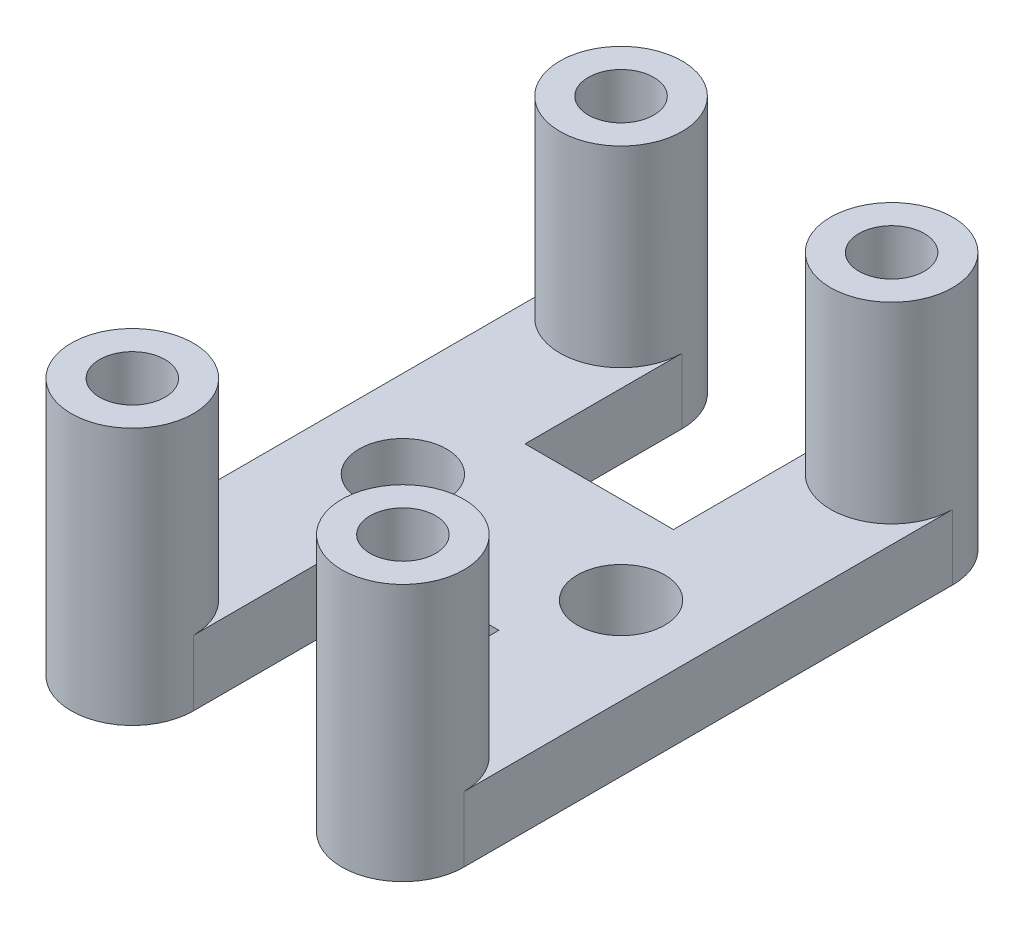
from build123d import *

# Parameters (mm, degrees)
SKETCH1_R           = 2.54
SKETCH1_R_2         = 1.905
BOSS_EXTRUDE1_DEPTH = 3.81
SKETCH4_R           = 3.556
SKETCH4_R_2         = 1.905
BOSS_EXTRUDE4_DEPTH = 11.176


with BuildPart() as part:
    # Sketch1 → Boss-Extrude1 (new body)
    with BuildSketch(Plane(origin=(0, 0, 0), x_dir=(1, 0, 0), z_dir=(0, 1, 0))):
        with BuildLine():
            Line((-9.948186072, 14.224), (-9.948186072, -14.224))
            ThreePointArc((-9.948186072, -14.224), (-6.392186072, -17.78), (-2.836186072, -14.224))
            Line((-2.836186072, -14.224), (-2.836186072, -5.08))
            Line((-2.836186072, -5.08), (5.799813928, -5.08))
            Line((5.799813928, -5.08), (5.799813928, -14.224))
            ThreePointArc((5.799813928, -14.224), (9.355813928, -17.78), (12.911813928, -14.224))
            Line((12.911813928, -14.224), (12.911813928, 14.224))
            ThreePointArc((12.911813928, 14.224), (9.355813928, 17.78), (5.799813928, 14.224))
            Line((5.799813928, 14.224), (5.799813928, 5.08))
            Line((5.799813928, 5.08), (-2.836186072, 5.08))
            Line((-2.836186072, 5.08), (-2.836186072, 14.224))
            ThreePointArc((-2.836186072, 14.224), (-6.392186072, 17.78), (-9.948186072, 14.224))
        make_face()
        with Locations(Location((7.831813928, 0, 0), (0, 0, 90))):
            Circle(SKETCH1_R, mode=Mode.SUBTRACT)
        with Locations(Location((-4.868186072, 0, 0), (0, 0, 90))):
            Circle(SKETCH1_R, mode=Mode.SUBTRACT)
        with Locations(Location((-6.392186072, 14.224, 0), (0, 0, 90))):
            Circle(SKETCH1_R_2, mode=Mode.SUBTRACT)
        with Locations(Location((-6.392186072, -14.224, 0), (0, 0, 90))):
            Circle(SKETCH1_R_2, mode=Mode.SUBTRACT)
        with Locations(Location((9.355813928, 14.224, 0), (0, 0, 90))):
            Circle(SKETCH1_R_2, mode=Mode.SUBTRACT)
        with Locations(Location((9.355813928, -14.224, 0), (0, 0, 90))):
            Circle(SKETCH1_R_2, mode=Mode.SUBTRACT)
    extrude(amount=BOSS_EXTRUDE1_DEPTH)

    # Sketch4 → Boss-Extrude4 (add)
    # profile 1 of 4: a face of its own
    with BuildSketch(Plane(origin=(0, 3.81, 0), x_dir=(1, 0, 0), z_dir=(0, 1, 0))):
        with Locations(Location((-6.392186072, 14.224, 0), (0, 0, 180))):
            Circle(SKETCH4_R)
        with Locations(Location((-6.392186072, 14.224, 0), (0, 0, 90))):
            Circle(SKETCH4_R_2, mode=Mode.SUBTRACT)
    # profile 2 of 4: a face of its own
    with BuildSketch(Plane(origin=(0, 3.81, 0), x_dir=(1, 0, 0), z_dir=(0, 1, 0))):
        with Locations(Location((9.355813928, 14.224, 0), (0, 0, 180))):
            Circle(SKETCH4_R)
        with Locations(Location((9.355813928, 14.224, 0), (0, 0, 90))):
            Circle(SKETCH4_R_2, mode=Mode.SUBTRACT)
    # profile 3 of 4: a face of its own
    with BuildSketch(Plane(origin=(0, 3.81, 0), x_dir=(1, 0, 0), z_dir=(0, 1, 0))):
        with Locations((9.355813928, -14.224)):
            Circle(SKETCH4_R)
        with Locations(Location((9.355813928, -14.224, 0), (0, 0, 90))):
            Circle(SKETCH4_R_2, mode=Mode.SUBTRACT)
    # profile 4 of 4: a face of its own
    with BuildSketch(Plane(origin=(0, 3.81, 0), x_dir=(1, 0, 0), z_dir=(0, 1, 0))):
        with Locations((-6.392186072, -14.224)):
            Circle(SKETCH4_R)
        with Locations(Location((-6.392186072, -14.224, 0), (0, 0, 90))):
            Circle(SKETCH4_R_2, mode=Mode.SUBTRACT)
    extrude(amount=BOSS_EXTRUDE4_DEPTH)


solid = part.part
